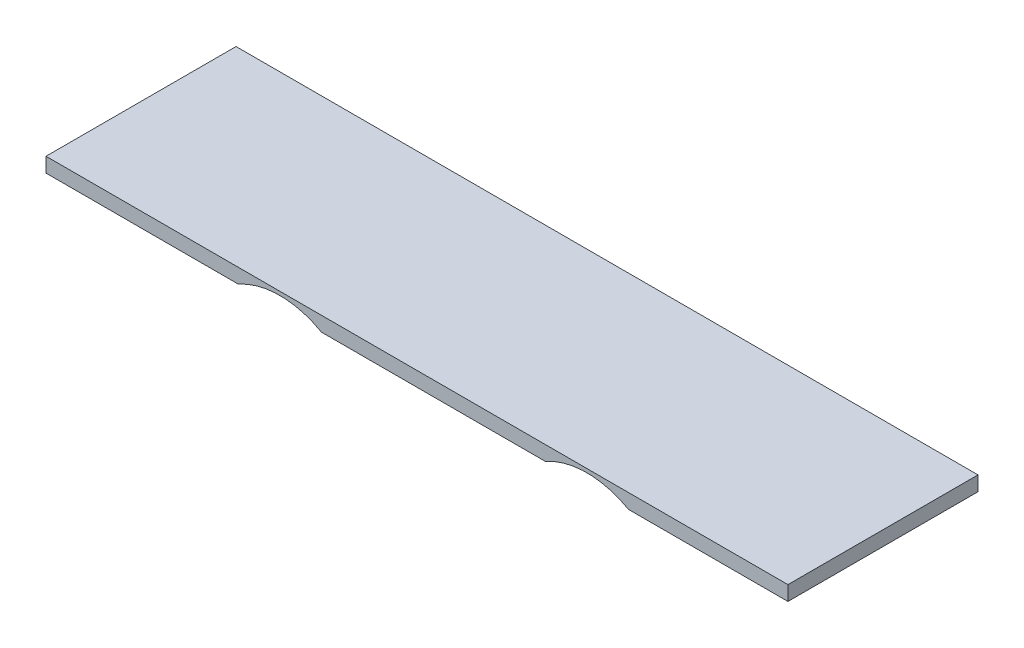
from build123d import *

# Parameters (mm, degrees)
BOSS_EXTRUDE1_DEPTH = 26


with BuildPart() as part:
    # Sketch1 → Boss-Extrude1 (new body)
    with BuildSketch(Plane.XY):
        with BuildLine():
            Line((0, 0), (101.5, 0))
            Line((101.5, 0), (101.5, -2))
            Line((101.5, -2), (79.678908346, -2))
            ThreePointArc((79.678908346, -2), (74, -0.5), (68.321091654, -2))
            Line((68.321091654, -2), (37.678908346, -2))
            ThreePointArc((37.678908346, -2), (32, -0.5), (26.321091654, -2))
            Line((26.321091654, -2), (0, -2))
            Line((0, -2), (0, 0))
        make_face()
    extrude(amount=BOSS_EXTRUDE1_DEPTH)


solid = part.part
